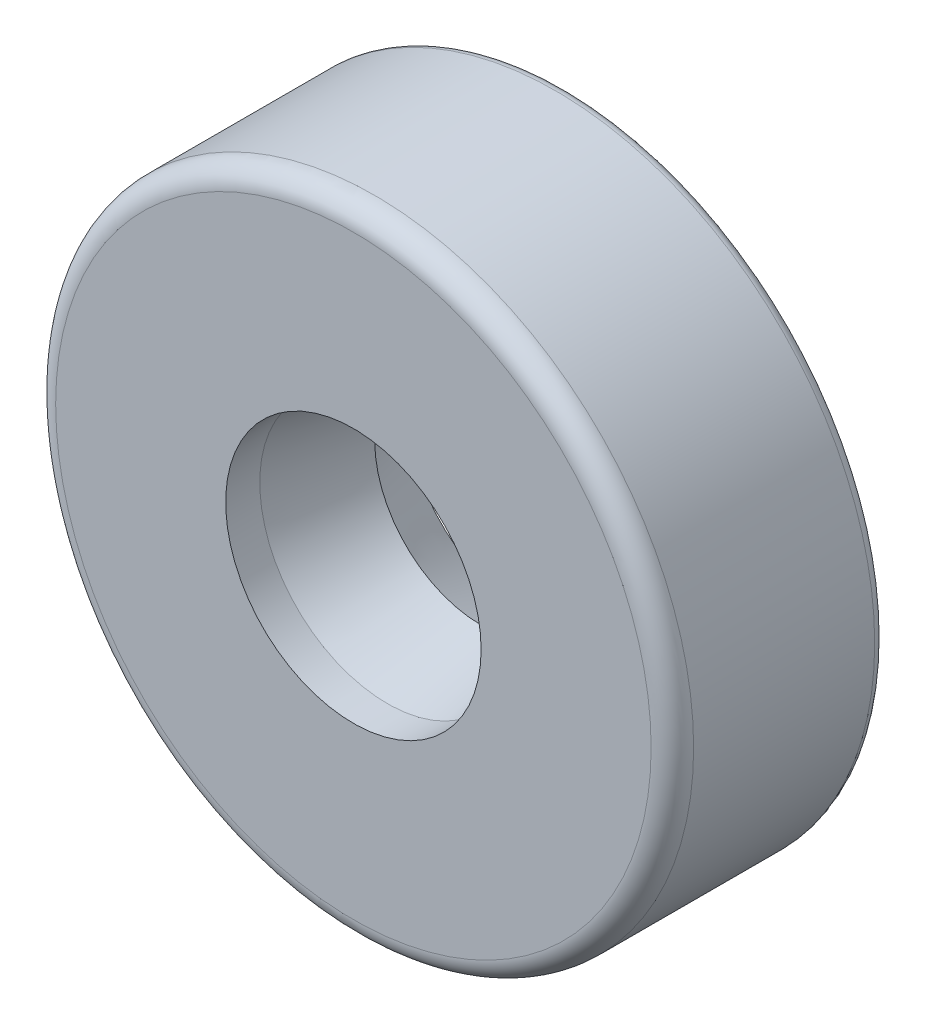
from build123d import *

# Parameters (mm, degrees)
SKETCH2_R = 0.514905625


with BuildPart() as part:
    # Sketch1 → Revolve1 (revolve)
    with BuildSketch(Plane(origin=(0, 0, 0), x_dir=(0, 0, -1), z_dir=(1, 0, 0)), mode=Mode.PRIVATE) as revolve1_sk:
        with BuildLine():
            Line((-3.175, 8.87857), (-3.175, 3.80873))
            Line((-3.175, 3.80873), (-2.159, 3.80873))
            Line((-2.159, 3.80873), (0.635, 3.175))
            Line((0.635, 3.175), (2.159, 3.80873))
            Line((2.159, 3.80873), (2.159, 4.44246))
            Line((2.159, 4.44246), (1.149905625, 4.44246))
            ThreePointArc((1.149905625, 4.44246), (0.635, 3.927554375), (0.120094375, 4.44246))
            Line((0.120094375, 4.44246), (-2.159, 4.44246))
            Line((-2.159, 4.44246), (-2.159, 8.363664375))
            ThreePointArc((-2.159, 8.363664375), (-2.008187634, 8.727757634), (-1.644094375, 8.87857))
            Line((-1.644094375, 8.87857), (2.6997025, 8.87857))
            ThreePointArc((2.6997025, 8.87857), (2.899140348, 9.031604043), (2.99534157, 8.79935375))
            Line((2.99534157, 8.79935375), (3.13254814, 8.7201375))
            ThreePointArc((3.13254814, 8.7201375), (3.164203087, 8.796559303), (3.175, 8.87857))
            Line((3.175, 8.87857), (3.175, 9.195435))
            ThreePointArc((3.175, 9.195435), (3.08219239, 9.41949239), (2.858135, 9.5123))
            Line((2.858135, 9.5123), (-2.54127, 9.5123))
            ThreePointArc((-2.54127, 9.5123), (-2.98938478, 9.32668478), (-3.175, 8.87857))
        make_face()
    revolve(revolve1_sk.sketch.rotate(Axis((0, 0, -3.175), (0, 0, 1)), 270), axis=Axis((0, 0, -3.175), (0, 0, 1)))


with BuildPart() as body_2:
    # Sketch2 → Revolve2 (revolve)
    with BuildSketch(Plane(origin=(0, 0, 0), x_dir=(0, 0, -1), z_dir=(1, 0, 0)), mode=Mode.PRIVATE) as revolve2_sk:
        with Locations((0.635, 4.44246)):
            Circle(SKETCH2_R)
    revolve(revolve2_sk.sketch.rotate(Axis((0, 0, 3.175), (0, 0, -1)), 270), axis=Axis((0, 0, 3.175), (0, 0, -1)))


solid = Compound([part.part, body_2.part])
